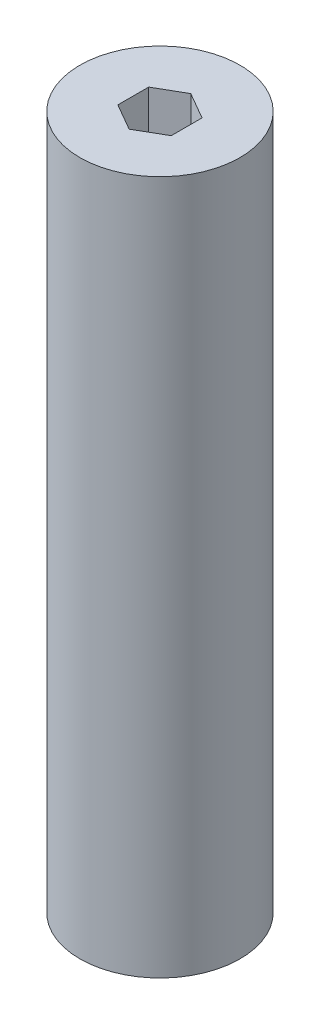
from build123d import *

# Parameters (mm, degrees)
SKETCH1_R           = 19.05
BOSS_EXTRUDE1_DEPTH = 165.1
CUT_EXTRUDE1_DEPTH  = 165.1


with BuildPart() as part:
    # Sketch1 → Boss-Extrude1 (new body)
    with BuildSketch(Plane(origin=(0, 0, 0), x_dir=(1, 0, 0), z_dir=(0, 1, 0))):
        with Locations(Location((0, 0, 0), (0, 0, 270))):
            Circle(SKETCH1_R)
    extrude(amount=BOSS_EXTRUDE1_DEPTH)

    # Sketch2 → Cut-Extrude1 (cut)
    with BuildSketch(Plane(origin=(0, 165.1, 0), x_dir=(1, 0, 0), z_dir=(0, 1, 0))):
        Polygon((0, 7.332348419), (-6.35, 3.666174209), (-6.35, -3.666174209), (0, -7.332348419), (6.35, -3.666174209), (6.35, 3.666174209), align=None)
    extrude(amount=-CUT_EXTRUDE1_DEPTH, mode=Mode.SUBTRACT)


solid = part.part
